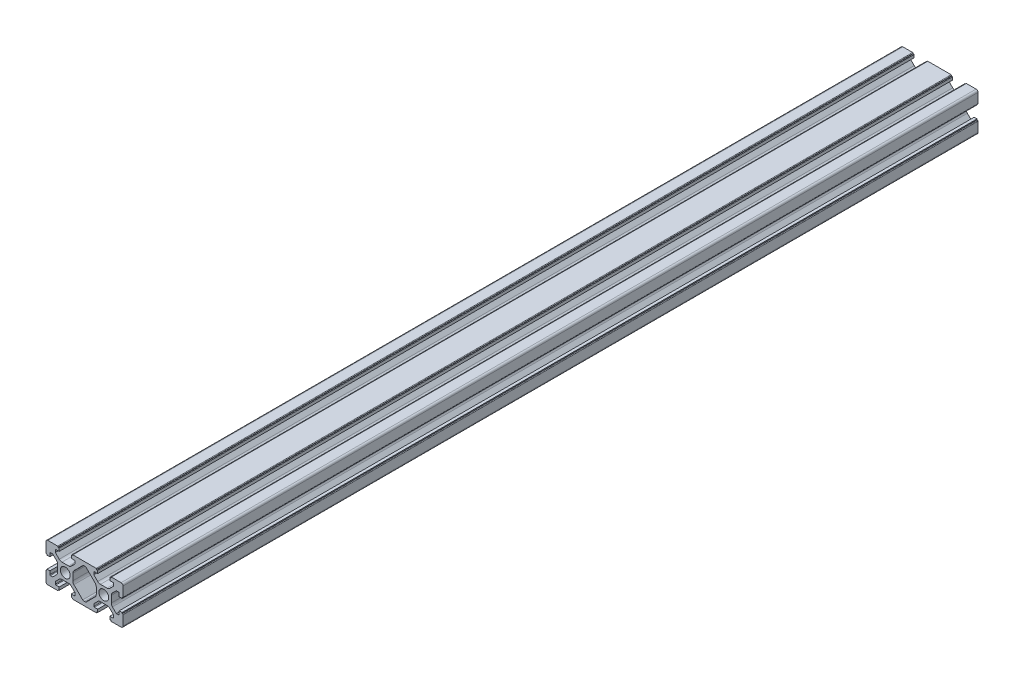
from build123d import *

# Parameters (mm, degrees)
CROQUIS1_R              = 2.55
SALIENTE_EXTRUIR1_DEPTH = 444


with BuildPart() as part:
    # Croquis1 → Saliente-Extruir1 (new body)
    with BuildSketch(Plane.XY):
        with BuildLine():
            Line((-20, -9), (-20, -3.95))
            ThreePointArc((-20, -3.95), (-19.912132034, -3.737867966), (-19.7, -3.65))
            Line((-19.7, -3.65), (-19.5, -3.65))
            Line((-19.5, -3.65), (-19.5, -3.15))
            Line((-19.5, -3.15), (-18, -3.15))
            Line((-18, -3.15), (-18, -4.85))
            ThreePointArc((-18, -4.85), (-17.912132034, -5.062132034), (-17.7, -5.15))
            Line((-17.7, -5.15), (-16.5, -5.15))
            Line((-16.5, -5.15), (-14.485786438, -3.135786438))
            ThreePointArc((-14.485786438, -3.135786438), (-14.052240935, -2.48693974), (-13.9, -1.721572875))
            Line((-13.9, -1.721572875), (-13.9, 1.721572875))
            ThreePointArc((-13.9, 1.721572875), (-14.052240935, 2.48693974), (-14.485786438, 3.135786438))
            Line((-14.485786438, 3.135786438), (-16.5, 5.15))
            Line((-16.5, 5.15), (-17.7, 5.15))
            ThreePointArc((-17.7, 5.15), (-17.912132034, 5.062132034), (-18, 4.85))
            Line((-18, 4.85), (-18, 3.15))
            Line((-18, 3.15), (-19.5, 3.15))
            Line((-19.5, 3.15), (-19.5, 3.65))
            Line((-19.5, 3.65), (-19.7, 3.65))
            ThreePointArc((-19.7, 3.65), (-19.912132034, 3.737867966), (-20, 3.95))
            Line((-20, 3.95), (-20, 9))
            ThreePointArc((-20, 9), (-19.707106781, 9.707106781), (-19, 10))
            Line((-19, 10), (-13.95, 10))
            ThreePointArc((-13.95, 10), (-13.737867966, 9.912132034), (-13.65, 9.7))
            Line((-13.65, 9.7), (-13.65, 9.5))
            Line((-13.65, 9.5), (-13.15, 9.5))
            Line((-13.15, 9.5), (-13.15, 8))
            Line((-13.15, 8), (-14.85, 8))
            ThreePointArc((-14.85, 8), (-15.062132034, 7.912132034), (-15.15, 7.7))
            Line((-15.15, 7.7), (-15.15, 6.5))
            Line((-15.15, 6.5), (-13.135786438, 4.485786438))
            ThreePointArc((-13.135786438, 4.485786438), (-12.48693974, 4.052240935), (-11.721572875, 3.9))
            Line((-11.721572875, 3.9), (-8.278427125, 3.9))
            ThreePointArc((-8.278427125, 3.9), (-7.51306026, 4.052240935), (-6.864213562, 4.485786438))
            Line((-6.864213562, 4.485786438), (-4.85, 6.5))
            Line((-4.85, 6.5), (-4.85, 7.7))
            ThreePointArc((-4.85, 7.7), (-4.937867966, 7.912132034), (-5.15, 8))
            Line((-5.15, 8), (-6.85, 8))
            Line((-6.85, 8), (-6.85, 9.5))
            Line((-6.85, 9.5), (-6.35, 9.5))
            Line((-6.35, 9.5), (-6.35, 9.7))
            ThreePointArc((-6.35, 9.7), (-6.262132034, 9.912132034), (-6.05, 10))
            Line((-6.05, 10), (6.05, 10))
            ThreePointArc((6.05, 10), (6.262132034, 9.912132034), (6.35, 9.7))
            Line((6.35, 9.7), (6.35, 9.5))
            Line((6.35, 9.5), (6.85, 9.5))
            Line((6.85, 9.5), (6.85, 8))
            Line((6.85, 8), (5.15, 8))
            ThreePointArc((5.15, 8), (4.937867966, 7.912132034), (4.85, 7.7))
            Line((4.85, 7.7), (4.85, 6.5))
            Line((4.85, 6.5), (6.864213562, 4.485786438))
            ThreePointArc((6.864213562, 4.485786438), (7.51306026, 4.052240935), (8.278427125, 3.9))
            Line((8.278427125, 3.9), (11.721572875, 3.9))
            ThreePointArc((11.721572875, 3.9), (12.48693974, 4.052240935), (13.135786438, 4.485786438))
            Line((13.135786438, 4.485786438), (15.15, 6.5))
            Line((15.15, 6.5), (15.15, 7.7))
            ThreePointArc((15.15, 7.7), (15.062132034, 7.912132034), (14.85, 8))
            Line((14.85, 8), (13.15, 8))
            Line((13.15, 8), (13.15, 9.5))
            Line((13.15, 9.5), (13.65, 9.5))
            Line((13.65, 9.5), (13.65, 9.7))
            ThreePointArc((13.65, 9.7), (13.737867966, 9.912132034), (13.95, 10))
            Line((13.95, 10), (19, 10))
            ThreePointArc((19, 10), (19.707106781, 9.707106781), (20, 9))
            Line((20, 9), (20, 3.95))
            ThreePointArc((20, 3.95), (19.912132034, 3.737867966), (19.7, 3.65))
            Line((19.7, 3.65), (19.5, 3.65))
            Line((19.5, 3.65), (19.5, 3.15))
            Line((19.5, 3.15), (18, 3.15))
            Line((18, 3.15), (18, 4.85))
            ThreePointArc((18, 4.85), (17.912132034, 5.062132034), (17.7, 5.15))
            Line((17.7, 5.15), (16.5, 5.15))
            Line((16.5, 5.15), (14.485786438, 3.135786438))
            ThreePointArc((14.485786438, 3.135786438), (14.052240935, 2.48693974), (13.9, 1.721572875))
            Line((13.9, 1.721572875), (13.9, -1.721572875))
            ThreePointArc((13.9, -1.721572875), (14.052240935, -2.48693974), (14.485786438, -3.135786438))
            Line((14.485786438, -3.135786438), (16.5, -5.15))
            Line((16.5, -5.15), (17.7, -5.15))
            ThreePointArc((17.7, -5.15), (17.912132034, -5.062132034), (18, -4.85))
            Line((18, -4.85), (18, -3.15))
            Line((18, -3.15), (19.5, -3.15))
            Line((19.5, -3.15), (19.5, -3.65))
            Line((19.5, -3.65), (19.7, -3.65))
            ThreePointArc((19.7, -3.65), (19.912132034, -3.737867966), (20, -3.95))
            Line((20, -3.95), (20, -9))
            ThreePointArc((20, -9), (19.707106781, -9.707106781), (19, -10))
            Line((19, -10), (13.65, -10))
            Line((13.65, -10), (13.65, -9.5))
            Line((13.65, -9.5), (13.15, -9.5))
            Line((13.15, -9.5), (13.15, -8))
            Line((13.15, -8), (14.85, -8))
            ThreePointArc((14.85, -8), (15.062132034, -7.912132034), (15.15, -7.7))
            Line((15.15, -7.7), (15.15, -6.5))
            Line((15.15, -6.5), (13.135786438, -4.485786438))
            ThreePointArc((13.135786438, -4.485786438), (12.48693974, -4.052240935), (11.721572875, -3.9))
            Line((11.721572875, -3.9), (8.278427125, -3.9))
            ThreePointArc((8.278427125, -3.9), (7.51306026, -4.052240935), (6.864213562, -4.485786438))
            Line((6.864213562, -4.485786438), (4.85, -6.5))
            Line((4.85, -6.5), (4.85, -7.7))
            ThreePointArc((4.85, -7.7), (4.937867966, -7.912132034), (5.15, -8))
            Line((5.15, -8), (6.85, -8))
            Line((6.85, -8), (6.85, -9.5))
            Line((6.85, -9.5), (6.35, -9.5))
            Line((6.35, -9.5), (6.35, -9.7))
            ThreePointArc((6.35, -9.7), (6.262132034, -9.912132034), (6.05, -10))
            Line((6.05, -10), (0, -10))
            Line((0, -10), (-6.05, -10))
            ThreePointArc((-6.05, -10), (-6.262132034, -9.912132034), (-6.35, -9.7))
            Line((-6.35, -9.7), (-6.35, -9.5))
            Line((-6.35, -9.5), (-6.85, -9.5))
            Line((-6.85, -9.5), (-6.85, -8))
            Line((-6.85, -8), (-5.15, -8))
            ThreePointArc((-5.15, -8), (-4.937867966, -7.912132034), (-4.85, -7.7))
            Line((-4.85, -7.7), (-4.85, -6.5))
            Line((-4.85, -6.5), (-6.864213562, -4.485786438))
            ThreePointArc((-6.864213562, -4.485786438), (-7.51306026, -4.052240935), (-8.278427125, -3.9))
            Line((-8.278427125, -3.9), (-11.721572875, -3.9))
            ThreePointArc((-11.721572875, -3.9), (-12.48693974, -4.052240935), (-13.135786438, -4.485786438))
            Line((-13.135786438, -4.485786438), (-15.15, -6.5))
            Line((-15.15, -6.5), (-15.15, -7.7))
            ThreePointArc((-15.15, -7.7), (-15.062132034, -7.912132034), (-14.85, -8))
            Line((-14.85, -8), (-13.15, -8))
            Line((-13.15, -8), (-13.15, -9.5))
            Line((-13.15, -9.5), (-13.65, -9.5))
            Line((-13.65, -9.5), (-13.65, -9.7))
            ThreePointArc((-13.65, -9.7), (-13.737867966, -9.912132034), (-13.95, -10))
            Line((-13.95, -10), (-19, -10))
            ThreePointArc((-19, -10), (-19.707106781, -9.707106781), (-20, -9))
        make_face()
        with Locations((-10, 0)):
            Circle(CROQUIS1_R, mode=Mode.SUBTRACT)
        with Locations((10, 0)):
            Circle(CROQUIS1_R, mode=Mode.SUBTRACT)
        with BuildLine():
            Line((-6.1, 1.721572875), (-6.1, -1.721572875))
            ThreePointArc((-6.1, -1.721572875), (-5.947759065, -2.48693974), (-5.514213562, -3.135786438))
            Line((-5.514213562, -3.135786438), (-3.5, -5.15))
            Line((-3.5, -5.15), (-0.942893219, -7.707106781))
            ThreePointArc((-0.942893219, -7.707106781), (-0.61846987, -7.923879533), (-0.235786438, -8))
            Line((-0.235786438, -8), (0.235786438, -8))
            ThreePointArc((0.235786438, -8), (0.61846987, -7.923879533), (0.942893219, -7.707106781))
            Line((0.942893219, -7.707106781), (3.5, -5.15))
            Line((3.5, -5.15), (5.514213562, -3.135786438))
            ThreePointArc((5.514213562, -3.135786438), (5.947759065, -2.48693974), (6.1, -1.721572875))
            Line((6.1, -1.721572875), (6.1, 1.721572875))
            ThreePointArc((6.1, 1.721572875), (5.947759065, 2.48693974), (5.514213562, 3.135786438))
            Line((5.514213562, 3.135786438), (3.5, 5.15))
            Line((3.5, 5.15), (0.942893219, 7.707106781))
            ThreePointArc((0.942893219, 7.707106781), (0.61846987, 7.923879533), (0.235786438, 8))
            Line((0.235786438, 8), (-0.235786438, 8))
            ThreePointArc((-0.235786438, 8), (-0.61846987, 7.923879533), (-0.942893219, 7.707106781))
            Line((-0.942893219, 7.707106781), (-3.5, 5.15))
            Line((-3.5, 5.15), (-5.514213562, 3.135786438))
            ThreePointArc((-5.514213562, 3.135786438), (-5.947759065, 2.48693974), (-6.1, 1.721572875))
        make_face(mode=Mode.SUBTRACT)
    extrude(amount=SALIENTE_EXTRUIR1_DEPTH)


solid = part.part
